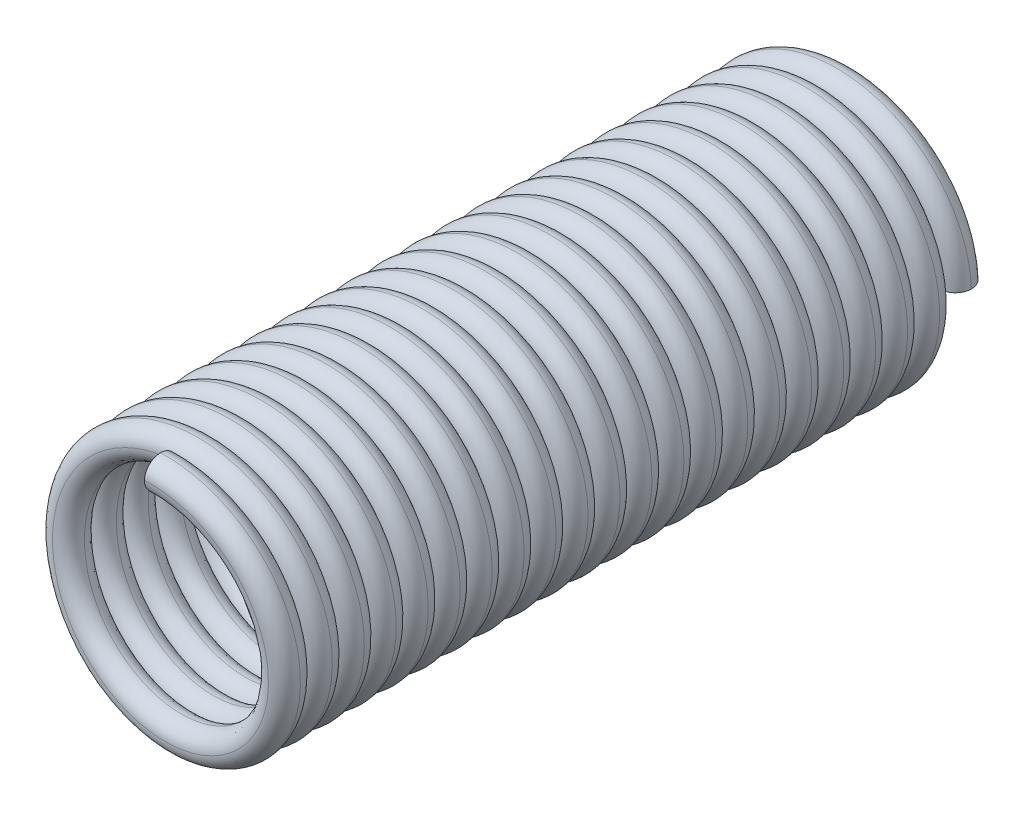
from build123d import *

# Parameters (mm, degrees)
BALAYAGE1_PITCH  = 8
BALAYAGE1_HEIGHT = 170
BALAYAGE1_RADIUS = 32.5
ESQUISSE4_R      = 4


with BuildPart() as part:
    # Balayage1: sweep along a helix
    with BuildLine() as balayage1_path:
        Helix(BALAYAGE1_PITCH, BALAYAGE1_HEIGHT, BALAYAGE1_RADIUS, center=(0, 0, 0), direction=(0, 0, 1))
    # Esquisse4 → Balayage1 (sweep)
    with BuildSketch(Plane(origin=(0, 0, 0), x_dir=(-1, 0, 0), z_dir=(0, -1, 0))):
        with Locations((-29, 0)):
            Circle(ESQUISSE4_R)
    sweep(path=balayage1_path.line, is_frenet=True)


solid = part.part
